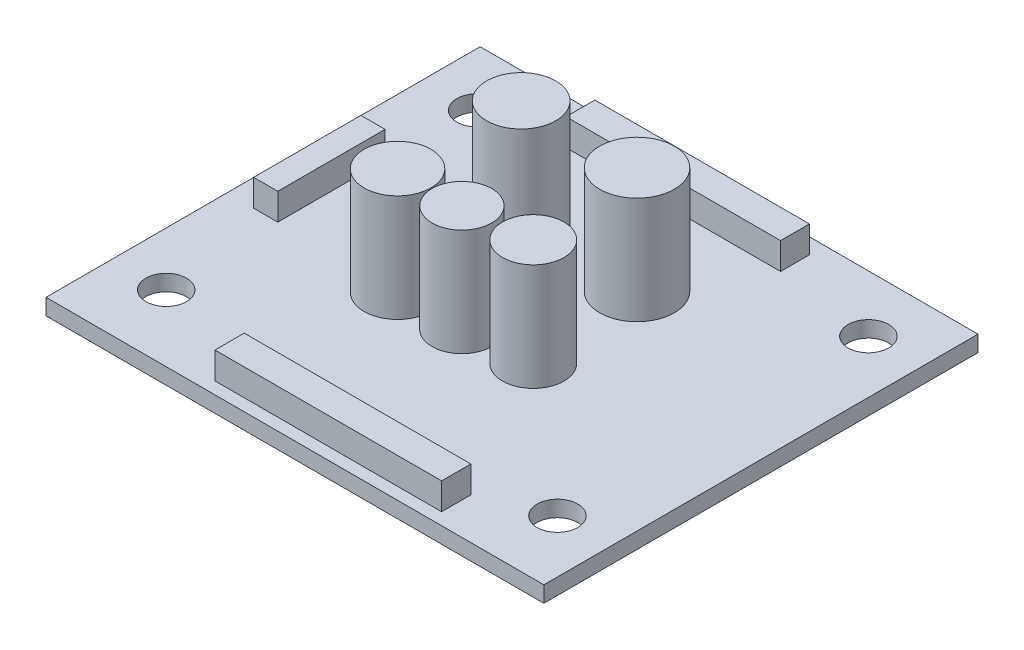
from build123d import *

# Parameters (mm, degrees)
SKETCH1_W           = 37.208239372
SKETCH1_H           = 32.443769696
SKETCH1_R           = 1.52
BOSS_EXTRUDE1_DEPTH = 1.2
SKETCH2_R           = 2.583124011
SKETCH2_R_2         = 2.790118195
SKETCH2_R_3         = 2.5
SKETCH2_R_4         = 2.297434725
SKETCH2_R_5         = 2.229489291
BOSS_EXTRUDE3_DEPTH = 8
SKETCH3_W           = 16.935717079
SKETCH3_H           = 2.186194115
SKETCH3_W_2         = 16.032090178
SKETCH3_H_2         = 2.157044861
SKETCH3_W_3         = 1.807253802
SKETCH3_H_3         = 8.016045089
BOSS_EXTRUDE4_DEPTH = 2


with BuildPart() as part:
    # Sketch1 → Boss-Extrude1 (new body)
    with BuildSketch(Plane(origin=(0, 0, 0), x_dir=(1, 0, 0), z_dir=(0, 1, 0))):
        with Locations((14.595582384, 11.248361917)):
            Rectangle(SKETCH1_W, SKETCH1_H)
        with Locations(Location((0, 0, 0), (0, 0, 270))):
            Circle(SKETCH1_R, mode=Mode.SUBTRACT)
        with Locations(Location((29.24, 0, 0), (0, 0, 270))):
            Circle(SKETCH1_R, mode=Mode.SUBTRACT)
        with Locations(Location((29.24, 23.24, 0), (0, 0, 270))):
            Circle(SKETCH1_R, mode=Mode.SUBTRACT)
        with Locations(Location((0, 23.24, 0), (0, 0, 270))):
            Circle(SKETCH1_R, mode=Mode.SUBTRACT)
    extrude(amount=BOSS_EXTRUDE1_DEPTH)

    # Sketch2 → Boss-Extrude3 (add)
    with BuildSketch(Plane(origin=(0, 1.2, 0), x_dir=(1, 0, 0), z_dir=(0, 1, 0))):
        with Locations(Location((9.028074704, 17.500877086, 0), (0, 0, 270))):
            Circle(SKETCH2_R)
        with Locations(Location((17.6854034, 17.500877086, 0), (0, 0, 270))):
            Circle(SKETCH2_R_2)
        with Locations(Location((8.794880665, 8.493757332, 0), (0, 0, 270))):
            Circle(SKETCH2_R_3)
        with Locations(Location((18.472433282, 8.960145409, 0), (0, 0, 270))):
            Circle(SKETCH2_R_4)
        with Locations(Location((13.604507718, 8.493757332, 0), (0, 0, 270))):
            Circle(SKETCH2_R_5)
    extrude(amount=BOSS_EXTRUDE3_DEPTH)

    # Sketch3 → Boss-Extrude4 (add)
    with BuildSketch(Plane(origin=(0, 1.2, 0), x_dir=(1, 0, 0), z_dir=(0, 1, 0))):
        with Locations((16.184216775, -2.976474459)):
            Rectangle(SKETCH3_W, SKETCH3_H)
        with Locations((13.750253993, 25.225429627)):
            Rectangle(SKETCH3_W_2, SKETCH3_H_2)
        with Locations((-1.115865991, 12.560078386)):
            Rectangle(SKETCH3_W_3, SKETCH3_H_3)
    extrude(amount=BOSS_EXTRUDE4_DEPTH)


solid = part.part
